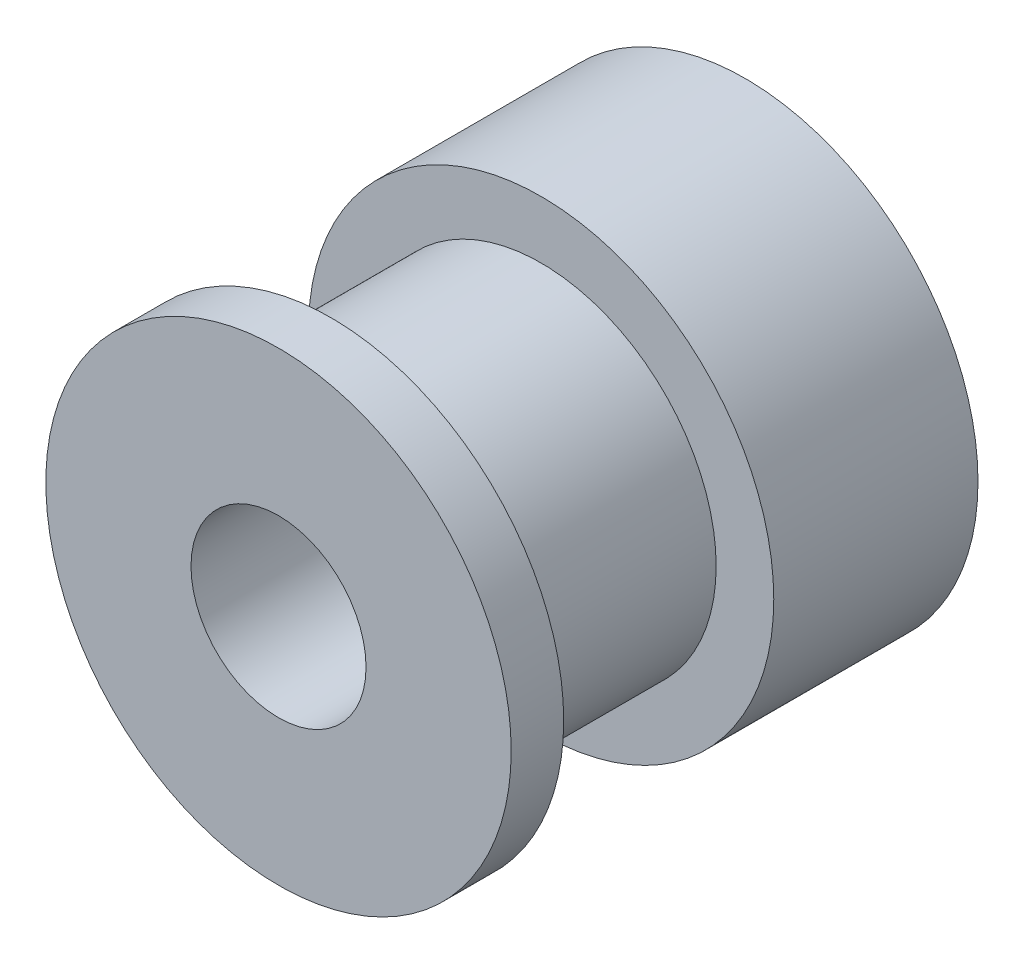
from build123d import *

# Parameters (mm, degrees)
SKETCH_1_R          = 7.975
EXTRUDE_1_DEPTH     = 7
SKETCH_2_R          = 6
EXTRUDE_2_DEPTH     = 7.2
SKETCH_3_R          = 7.975
EXTRUDE_3_DEPTH     = 1.8
SKETCH_4_R          = 3
CUT_EXTRUDE_1_DEPTH = 20.575526813


with BuildPart() as part:
    # 草图1 → 凸台-拉伸1 (new body)
    with BuildSketch(Plane.XY):
        Circle(SKETCH_1_R)
    extrude(amount=EXTRUDE_1_DEPTH)

    # 草图2 → 凸台-拉伸2 (add)
    with BuildSketch(Plane.XY.offset(7)):
        Circle(SKETCH_2_R)
    extrude(amount=EXTRUDE_2_DEPTH)

    # 草图3 → 凸台-拉伸3 (add)
    with BuildSketch(Plane.XY.offset(14.2)):
        Circle(SKETCH_3_R)
    extrude(amount=EXTRUDE_3_DEPTH)

    # 草图4 → 切除-拉伸1 (cut, through all)
    with BuildSketch(Plane.XY.offset(16)):
        Circle(SKETCH_4_R)
    extrude(amount=-CUT_EXTRUDE_1_DEPTH, mode=Mode.SUBTRACT)


solid = part.part
